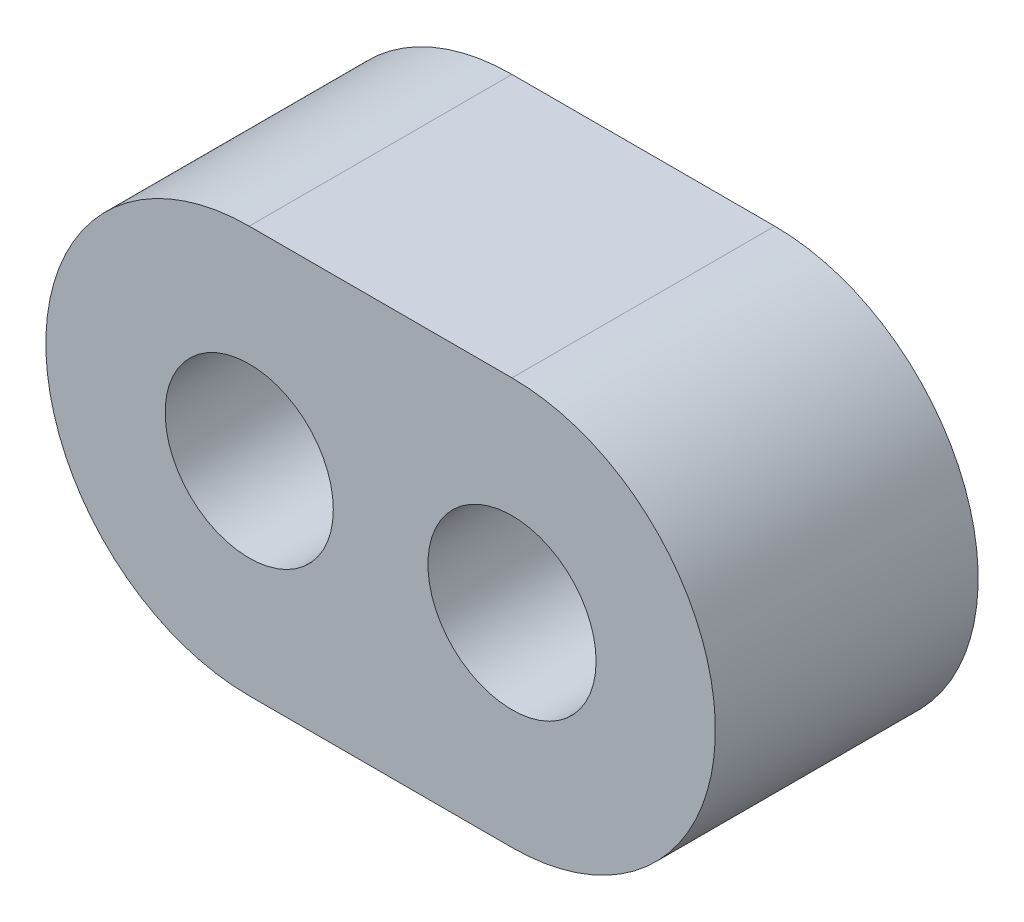
from build123d import *

# Parameters (mm, degrees)
SKETCH_1_R      = 1.6
EXTRUDE_1_DEPTH = 5


with BuildPart() as part:
    # 草图1 → 凸台-拉伸1 (new body)
    with BuildSketch(Plane.XY):
        with BuildLine():
            Line((0, 3.869699764), (5, 3.869699764))
            ThreePointArc((5, 3.869699764), (8.869699764, 0), (5, -3.869699764))
            Line((5, -3.869699764), (0, -3.869699764))
            ThreePointArc((0, -3.869699764), (-3.869699764, 0), (0, 3.869699764))
        make_face()
        Circle(SKETCH_1_R, mode=Mode.SUBTRACT)
        with Locations((5, 0)):
            Circle(SKETCH_1_R, mode=Mode.SUBTRACT)
    extrude(amount=EXTRUDE_1_DEPTH)


solid = part.part
